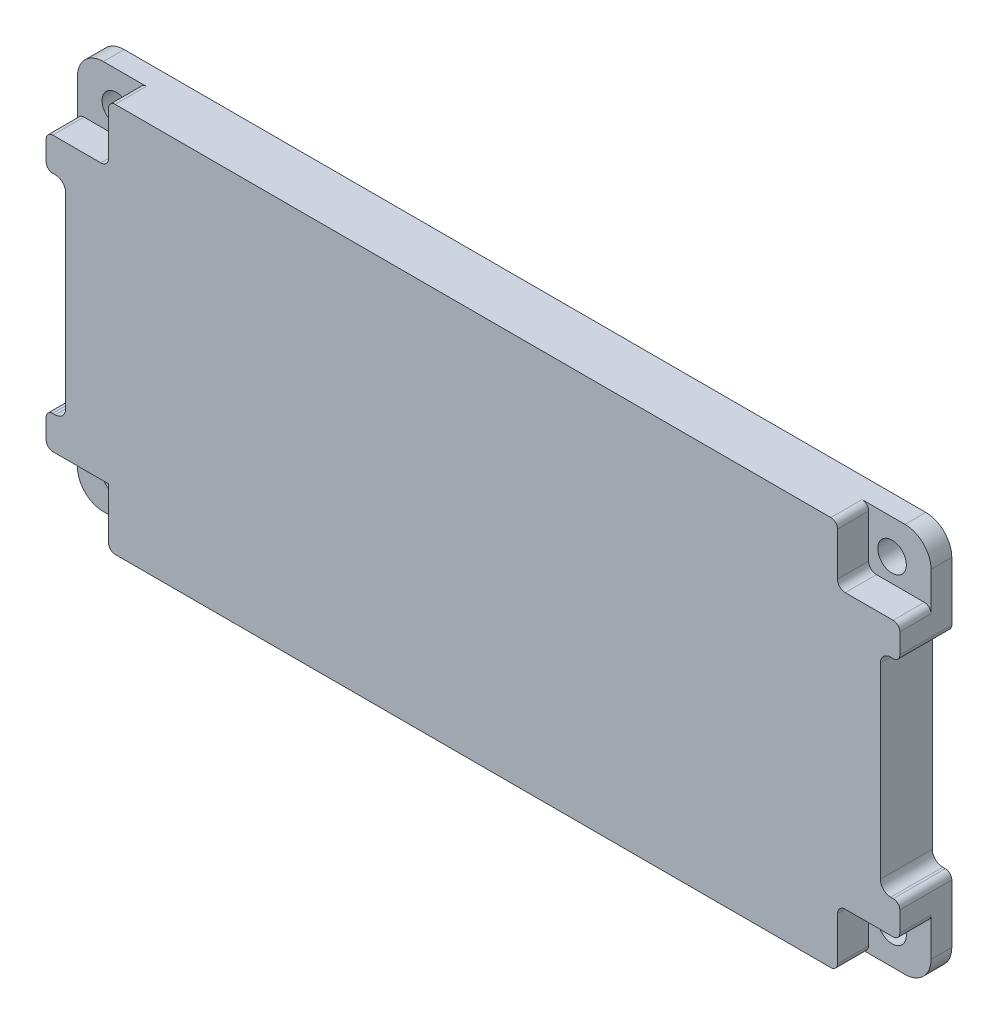
from build123d import *

# Parameters (mm, degrees)
SKETCH_2_W          = 65.7
SKETCH_2_H          = 30
EXTRUDE_1_DEPTH     = 4
FILLET_1_R          = 2
SKETCH_5_R          = 1.1
SKETCH_5_W          = 1.5
SKETCH_5_H          = 16
CUT_EXTRUDE_6_DEPTH = 37.333490061
SKETCH_3_W          = 4.8
SKETCH_3_H          = 4.45
SKETCH_3_R          = 1.1
CUT_EXTRUDE_5_DEPTH = 2.4
FILLET_7_R          = 0.51
FILLET_8_R          = 0.6
FILLET_9_R          = 0.5
FILLET_10_R         = 0.8


with BuildPart() as part:
    # 스케치2 → 보스-돌출1 (new body)
    with BuildSketch(Plane.XY):
        Rectangle(SKETCH_2_W, SKETCH_2_H)
    extrude(amount=EXTRUDE_1_DEPTH)

    # 필렛1
    fillet_1_edges = [part.edges().sort_by_distance(p)[0] for p in [
        (32.85, 15, 2),
        (32.85, -15, 2),
        (-32.85, -15, 2),
        (-32.85, 15, 2),
    ]]
    fillet(fillet_1_edges, radius=FILLET_1_R)

    # 스케치5 → 컷-돌출6 (cut, through all)
    with BuildSketch(Plane.XY.offset(4)):
        with Locations((-29.85, 12.35)):
            Circle(SKETCH_5_R)
        with Locations(Location((29.85, 12.35, 0), (0, 0, 180))):
            Circle(SKETCH_5_R)
        with Locations((29.85, -12.35)):
            Circle(SKETCH_5_R)
        with Locations(Location((-29.85, -12.35, 0), (0, 0, 180))):
            Circle(SKETCH_5_R)
        with Locations((-32.1, 0)):
            Rectangle(SKETCH_5_W, SKETCH_5_H)
        with Locations((32.1, 0)):
            Rectangle(SKETCH_5_W, SKETCH_5_H)
    extrude(amount=-CUT_EXTRUDE_6_DEPTH, mode=Mode.SUBTRACT)

    # 스케치3 → 컷-돌출5 (cut)
    # profile 1 of 4: a face of its own
    with BuildSketch(Plane.XY.offset(4)):
        with Locations((-30.45, 12.775)):
            Rectangle(SKETCH_3_W, SKETCH_3_H)
        with Locations((-29.85, 12.35)):
            Circle(SKETCH_3_R, mode=Mode.SUBTRACT)
    # profile 2 of 4: a face of its own
    with BuildSketch(Plane.XY.offset(4)):
        with Locations((-30.45, -12.775)):
            Rectangle(SKETCH_3_W, SKETCH_3_H)
        with Locations(Location((-29.85, -12.35, 0), (0, 0, 180))):
            Circle(SKETCH_3_R, mode=Mode.SUBTRACT)
    # profile 3 of 4: a face of its own
    with BuildSketch(Plane.XY.offset(4)):
        with Locations((30.45, -12.775)):
            Rectangle(SKETCH_3_W, SKETCH_3_H)
        with Locations((29.85, -12.35)):
            Circle(SKETCH_3_R, mode=Mode.SUBTRACT)
    # profile 4 of 4: a face of its own
    with BuildSketch(Plane.XY.offset(4)):
        with Locations((30.45, 12.775)):
            Rectangle(SKETCH_3_W, SKETCH_3_H)
        with Locations(Location((29.85, 12.35, 0), (0, 0, 180))):
            Circle(SKETCH_3_R, mode=Mode.SUBTRACT)
    extrude(amount=-CUT_EXTRUDE_5_DEPTH, mode=Mode.SUBTRACT)

    # 필렛7
    fillet_7_edges = [part.edges().sort_by_distance(p)[0] for p in [
        (-32.85, -10.55, 2.8),
        (-28.05, -15, 2.8),
        (28.05, -15, 2.8),
        (32.85, -10.55, 2.8),
        (32.85, 10.55, 2.8),
        (28.05, 15, 2.8),
        (-28.05, 15, 2.8),
        (-32.85, 10.55, 2.8),
    ]]
    fillet(fillet_7_edges, radius=FILLET_7_R)

    # 필렛8
    fillet_8_edges = [part.edges().sort_by_distance(p)[0] for p in [
        (28.05, -10.55, 2.8),
        (28.05, 10.55, 2.8),
        (-28.05, 10.55, 2.8),
    ]]
    fillet(fillet_8_edges, radius=FILLET_8_R)

    # 필렛9
    fillet_9_edges = [part.edges().sort_by_distance(p)[0] for p in [
        (32.85, 8, 2),
        (32.85, -8, 2),
        (-32.85, -8, 2),
        (-32.85, 8, 2),
    ]]
    fillet(fillet_9_edges, radius=FILLET_9_R)

    # 필렛10
    fillet_10_edges = [part.edges().sort_by_distance(p)[0] for p in [
        (31.35, 8, 2),
        (31.35, -8, 2),
        (-31.35, 8, 2),
        (-31.35, -8, 2),
    ]]
    fillet(fillet_10_edges, radius=FILLET_10_R)


solid = part.part
